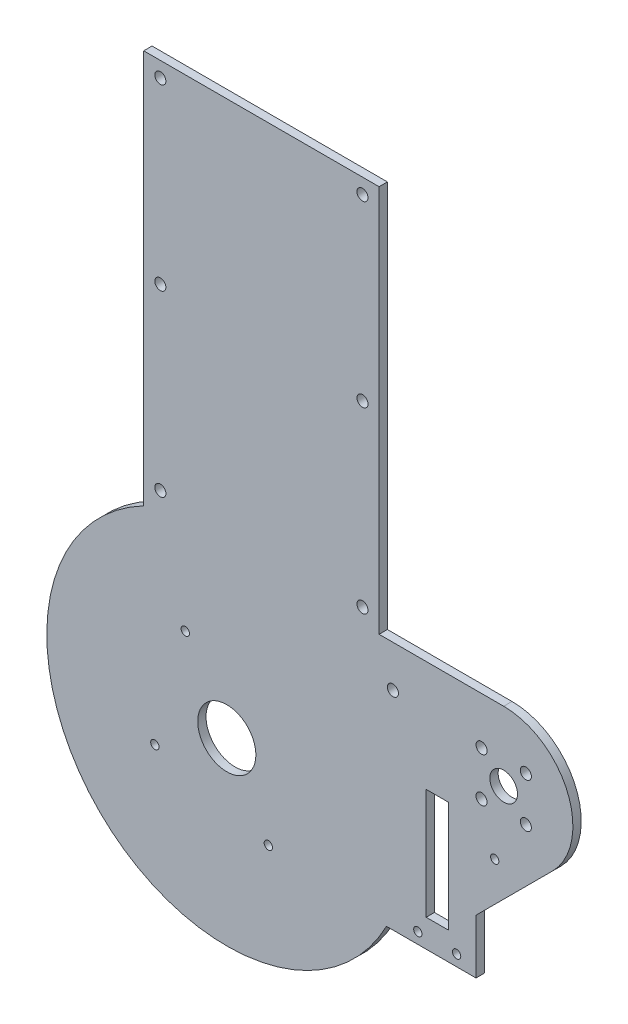
from build123d import *
from build123d.topology import SkipClean

# Parameters (mm, degrees)
SKETCH1_R           = 10.5
SKETCH1_R_2         = 1.5
SKETCH1_W           = 8
SKETCH1_H           = 40
SKETCH1_R_3         = 5
BOSS_EXTRUDE1_DEPTH = 3
CUT_EXTRUDE1_REACH  = 140.687
SKETCH2_R           = 2
BOSS_EXTRUDE2_DEPTH = 3
SKETCH4_W           = 2
SKETCH4_H           = 6.5
SKETCH4_W_2         = 6.5
SKETCH4_H_2         = 2
BOSS_EXTRUDE3_DEPTH = 1
SKETCH5_R           = 2
CUT_EXTRUDE2_DEPTH  = 10
BOSS_EXTRUDE4_START = -3
BOSS_EXTRUDE4_DEPTH = 3
SKETCH7_R           = 2
CUT_EXTRUDE3_DEPTH  = 10
BOSS_EXTRUDE5_START = -3
SKETCH8_R           = 65
SKETCH8_R_2         = 10.5
BOSS_EXTRUDE5_DEPTH = 3
CUT_EXTRUDE4_START  = -10
CUT_EXTRUDE4_DEPTH  = 10
CUT_EXTRUDE5_REACH  = 237.883
SKETCH10_R          = 1.5


with BuildPart() as part:
    # Sketch1 → Boss-Extrude1 (new body)
    # profile 1 of 2: a face of its own
    with BuildSketch(Plane.XY):
        with BuildLine():
            ThreePointArc((-60, 0), (-52.867640737, 28.372743309), (-33.166247904, 50))
            Line((-33.166247904, 50), (-60, 50))
            Line((-60, 50), (-60, 0))
        make_face()
    # profile 2 of 2: a face of its own
    with BuildSketch(Plane.XY):
        with BuildLine():
            ThreePointArc((0, 60), (-17.320508076, 57.445626465), (-33.166247904, 50))
            ThreePointArc((-33.166247904, 50), (-52.867640737, 28.372743309), (-60, 0))
            ThreePointArc((-60, 0), (-15.529142706, -57.955549577), (51.961524227, -30))
            Line((51.961524227, -30), (56.882127578, -30))
            Line((56.882127578, -30), (90, -30))
            Line((90, -30), (90, -10.355339059))
            Line((90, -10.355339059), (117.67766953, 17.32233047))
            ThreePointArc((117.67766953, 17.32233047), (123.096988313, 44.567085809), (100, 60))
            Line((100, 60), (0, 60))
        make_face()
        Circle(SKETCH1_R, mode=Mode.SUBTRACT)
        with Locations((69, -26)):
            Circle(SKETCH1_R_2, mode=Mode.SUBTRACT)
        with Locations((76, 0)):
            Rectangle(SKETCH1_W, SKETCH1_H, mode=Mode.SUBTRACT)
        with Locations((83, -26)):
            Circle(SKETCH1_R_2, mode=Mode.SUBTRACT)
        with Locations((100, 35)):
            Circle(SKETCH1_R_3, mode=Mode.SUBTRACT)
    extrude(amount=BOSS_EXTRUDE1_DEPTH)

    # Sketch2 → Cut-Extrude1 (cut, up to next)
    with BuildSketch(Plane.XY.offset(3), mode=Mode.PRIVATE) as cut_extrude1_sk1:
        with Locations((60, 45)):
            Circle(SKETCH2_R)
    cut_extrude1_tool1 = extrude(cut_extrude1_sk1.sketch, amount=-CUT_EXTRUDE1_REACH, mode=Mode.PRIVATE) & part.part
    add(cut_extrude1_tool1.solids().sort_by_distance((60, 45, 3))[0], mode=Mode.SUBTRACT)

    # Sketch3 → Boss-Extrude2 (add)
    with BuildSketch(Plane(origin=(0, 0, 0), x_dir=(-1, 0, 0), z_dir=(0, 0, -1))):
        with BuildLine():
            Line((-30, 80), (-30, 60))
            Line((-30, 60), (0, 60))
            ThreePointArc((0, 60), (2.502176759, 59.947803225), (5, 59.791303716))
            Line((5, 59.791303716), (5, 80))
            Line((5, 80), (-30, 80))
        make_face()
    extrude(amount=-BOSS_EXTRUDE2_DEPTH)

    # Sketch4 → Boss-Extrude3 (add)
    with BuildSketch(Plane(origin=(0, 0, 0), x_dir=(-1, 0, 0), z_dir=(0, 0, -1))):
        with Locations((-12.5, 68.846087829)):
            Rectangle(SKETCH4_W, SKETCH4_H)
        with Locations((-16.75, 64.596087829)):
            Rectangle(SKETCH4_W_2, SKETCH4_H_2)
        with Locations((-12.5, 64.596087829)):
            Rectangle(SKETCH4_W, SKETCH4_H_2)
        with Locations((-8.25, 64.596087829)):
            Rectangle(SKETCH4_W_2, SKETCH4_H_2)
        with Locations((-12.5, 60.346087829)):
            Rectangle(SKETCH4_W, SKETCH4_H)
    extrude(amount=BOSS_EXTRUDE3_DEPTH)

    # Sketch5 → Cut-Extrude2 (cut)
    with BuildSketch(Plane.XY.offset(3)):
        with Locations((92, 43)):
            Circle(SKETCH5_R)
        with Locations((108, 43)):
            Circle(SKETCH5_R)
        with Locations((108, 27)):
            Circle(SKETCH5_R)
        with Locations((92, 27)):
            Circle(SKETCH5_R)
    extrude(amount=-CUT_EXTRUDE2_DEPTH, mode=Mode.SUBTRACT)

    # Sketch6 → Boss-Extrude4 (add)
    with BuildSketch(Plane.XY.offset(3).offset(BOSS_EXTRUDE4_START)):
        with BuildLine():
            Line((12.5, 60), (55, 60))
            Line((55, 60), (55, 200))
            Line((55, 200), (-30, 200))
            Line((-30, 200), (-30, 60))
            Line((-30, 60), (-30, 51.961524227))
            ThreePointArc((-30, 51.961524227), (-17.93255034, 57.257520364), (-5, 59.791303716))
            Line((-5, 59.791303716), (-5, 60))
            Line((-5, 60), (12.5, 60))
        make_face()
    extrude(amount=BOSS_EXTRUDE4_DEPTH)

    # Sketch7 → Cut-Extrude3 (cut)
    with BuildSketch(Plane.XY.offset(3)):
        with Locations((-24, 194.5)):
            Circle(SKETCH7_R)
        with Locations((49, 194.5)):
            Circle(SKETCH7_R)
        with Locations((49, 65.5)):
            Circle(SKETCH7_R)
        with Locations((-24, 65.5)):
            Circle(SKETCH7_R)
        with Locations((-24, 130)):
            Circle(SKETCH7_R)
        with Locations((49, 130)):
            Circle(SKETCH7_R)
    extrude(amount=-CUT_EXTRUDE3_DEPTH, mode=Mode.SUBTRACT)

    # Sketch8 → Boss-Extrude5 (add)
    with BuildSketch(Plane.XY.offset(3).offset(BOSS_EXTRUDE5_START)):
        Circle(SKETCH8_R)
        Circle(SKETCH8_R_2, mode=Mode.SUBTRACT)
    extrude(amount=BOSS_EXTRUDE5_DEPTH)

    # Sketch9 → Cut-Extrude4 (cut)
    with SkipClean():  # the faces are left unmerged after this step: merging them gives an invalid solid
        with BuildSketch(Plane.XY.offset(3).offset(CUT_EXTRUDE4_START)):
            with BuildLine():
                Line((-60, 50), (-60, 25))
                ThreePointArc((-60, 25), (-52.282822987, 38.62002616), (-41.533119315, 50))
                Line((-41.533119315, 50), (-60, 50))
            make_face()
        extrude(amount=CUT_EXTRUDE4_DEPTH, mode=Mode.SUBTRACT)

    # Sketch10 → Cut-Extrude5 (cut, up to next)
    with BuildSketch(Plane.XY.offset(3), mode=Mode.PRIVATE) as cut_extrude5_sk1:
        with Locations((-15, 25.980762114)):
            Circle(SKETCH10_R)
    cut_extrude5_tool1 = extrude(cut_extrude5_sk1.sketch, amount=-CUT_EXTRUDE5_REACH, mode=Mode.PRIVATE) & part.part
    # Sketch10 → Cut-Extrude5 (cut, up to next)
    with BuildSketch(Plane.XY.offset(3), mode=Mode.PRIVATE) as cut_extrude5_sk2:
        with Locations((-25.980762114, -15)):
            Circle(SKETCH10_R)
    cut_extrude5_tool2 = extrude(cut_extrude5_sk2.sketch, amount=-CUT_EXTRUDE5_REACH, mode=Mode.PRIVATE) & part.part
    # Sketch10 → Cut-Extrude5 (cut, up to next)
    with BuildSketch(Plane.XY.offset(3), mode=Mode.PRIVATE) as cut_extrude5_sk3:
        with Locations((15, -25.980762114)):
            Circle(SKETCH10_R)
    cut_extrude5_tool3 = extrude(cut_extrude5_sk3.sketch, amount=-CUT_EXTRUDE5_REACH, mode=Mode.PRIVATE) & part.part
    # Sketch10 → Cut-Extrude5 (cut, up to next)
    with BuildSketch(Plane.XY.offset(3), mode=Mode.PRIVATE) as cut_extrude5_sk4:
        with Locations((96.767766953, 10.554563517)):
            Circle(SKETCH10_R)
    cut_extrude5_tool4 = extrude(cut_extrude5_sk4.sketch, amount=-CUT_EXTRUDE5_REACH, mode=Mode.PRIVATE) & part.part
    add(cut_extrude5_tool1.solids().sort_by_distance((-15, 25.980762, 3))[0], mode=Mode.SUBTRACT)
    add(cut_extrude5_tool2.solids().sort_by_distance((-25.980762, -15, 3))[0], mode=Mode.SUBTRACT)
    add(cut_extrude5_tool3.solids().sort_by_distance((15, -25.980762, 3))[0], mode=Mode.SUBTRACT)
    add(cut_extrude5_tool4.solids().sort_by_distance((96.767767, 10.554564, 3))[0], mode=Mode.SUBTRACT)


solid = part.part
